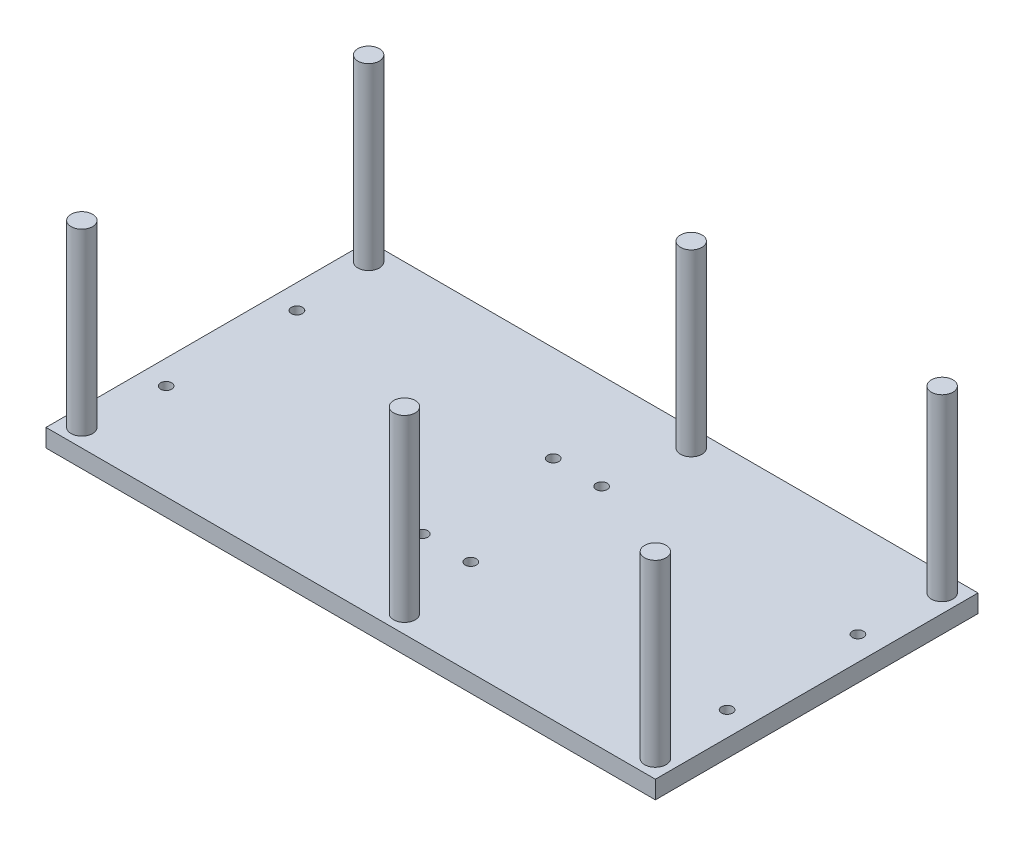
from build123d import *

# Parameters (mm, degrees)
SKETCH1_W           = 170
SKETCH1_H           = 90
BOSS_EXTRUDE1_DEPTH = 5
SKETCH2_R           = 3
BOSS_EXTRUDE2_DEPTH = 50
SKETCH3_R           = 1.55
CUT_EXTRUDE1_DEPTH  = 50


with BuildPart() as part:
    # Sketch1 → Boss-Extrude1 (new body)
    with BuildSketch(Plane(origin=(0, 0, 0), x_dir=(1, 0, 0), z_dir=(0, 1, 0))):
        with Locations((85, 45)):
            Rectangle(SKETCH1_W, SKETCH1_H)
    extrude(amount=BOSS_EXTRUDE1_DEPTH)

    # Sketch2 → Boss-Extrude2 (add)
    with BuildSketch(Plane(origin=(0, 5, 0), x_dir=(1, 0, 0), z_dir=(0, 1, 0))):
        with Locations(Location((5, 85, 0), (0, 0, 90))):
            Circle(SKETCH2_R)
        with Locations(Location((5, 5, 0), (0, 0, 90))):
            Circle(SKETCH2_R)
        with Locations(Location((165, 5, 0), (0, 0, 90))):
            Circle(SKETCH2_R)
        with Locations(Location((165, 85, 0), (0, 0, 90))):
            Circle(SKETCH2_R)
        with Locations(Location((95, 85, 0), (0, 0, 90))):
            Circle(SKETCH2_R)
        with Locations(Location((95, 5, 0), (0, 0, 90))):
            Circle(SKETCH2_R)
    extrude(amount=BOSS_EXTRUDE2_DEPTH)

    # Sketch3 → Cut-Extrude1 (cut)
    with BuildSketch(Plane.XZ):
        with Locations(Location((6.75, -26.75, 0), (0, 0, 270))):
            Circle(SKETCH3_R)
        with Locations(Location((78.25, -26.75, 0), (0, 0, 270))):
            Circle(SKETCH3_R)
        with Locations(Location((78.25, -63.25, 0), (0, 0, 270))):
            Circle(SKETCH3_R)
        with Locations(Location((6.75, -63.25, 0), (0, 0, 270))):
            Circle(SKETCH3_R)
        with Locations(Location((163.25, -63.25, 0), (0, 0, 270))):
            Circle(SKETCH3_R)
        with Locations(Location((91.75, -63.25, 0), (0, 0, 270))):
            Circle(SKETCH3_R)
        with Locations(Location((91.75, -26.75, 0), (0, 0, 270))):
            Circle(SKETCH3_R)
        with Locations(Location((163.25, -26.75, 0), (0, 0, 270))):
            Circle(SKETCH3_R)
    extrude(amount=-CUT_EXTRUDE1_DEPTH, mode=Mode.SUBTRACT)


solid = part.part
